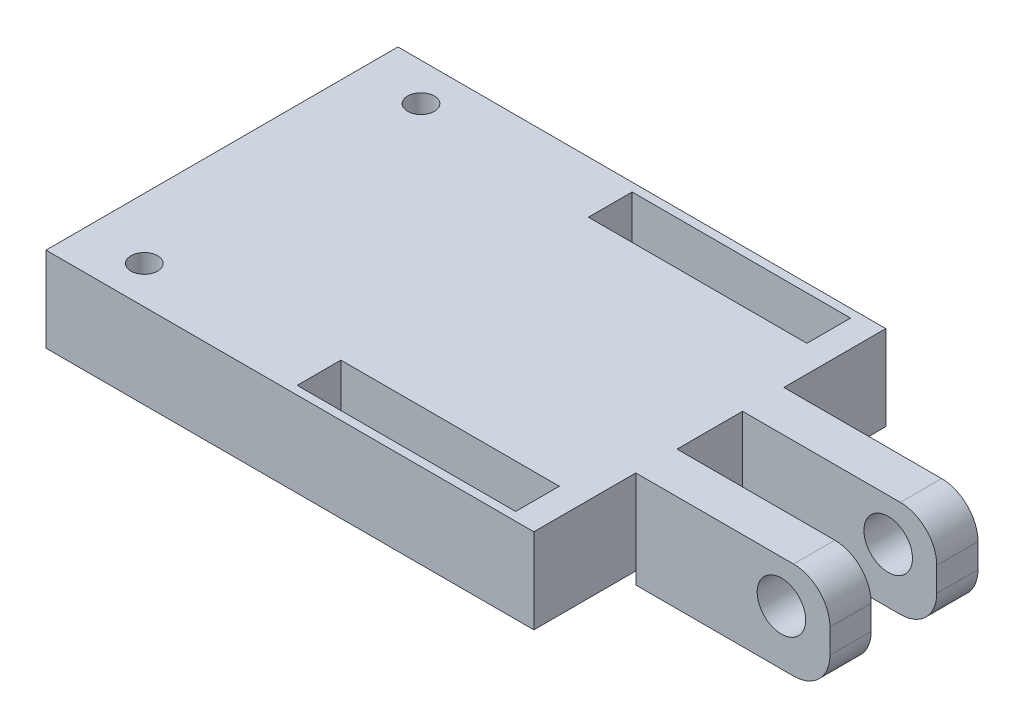
from build123d import *

# Parameters (mm, degrees)
SKETCH2_W               = 50.8
SKETCH2_H               = 36.83
BOSS_EXTRUDE1_DEPTH     = 8.89
SKETCH14_W              = 36.83
SKETCH14_H              = 8.89
BOSS_EXTRUDE6_DEPTH     = 0.254
SKETCH15_W              = 4.318
SKETCH15_H              = 10.16
BOSS_EXTRUDE7_DEPTH     = 20.32
CUT_EXTRUDE3_DEPTH      = 54.86357322
CUT_EXTRUDE3_DEPTH_BACK = 54.86357322
SKETCH16_R              = 2.54
FILLET1_R               = 3.81
SKETCH18_R              = 1.397
CUT_EXTRUDE5_DEPTH      = 2.286
SKETCH18_5_W            = 22.86
SKETCH18_5_H            = 4.572
CUT_EXTRUDE6_DEPTH      = 7.62
SKETCH18_6_W            = 22.86
SKETCH18_6_H            = 4.572
CUT_EXTRUDE7_DEPTH      = 7.62


with BuildPart() as part:
    # Sketch2 → Boss-Extrude1 (new body)
    with BuildSketch(Plane(origin=(0, 0, 0), x_dir=(1, 0, 0), z_dir=(0, 1, 0))):
        Rectangle(SKETCH2_W, SKETCH2_H)
    extrude(amount=-BOSS_EXTRUDE1_DEPTH)

    # Sketch14 → Boss-Extrude6 (add)
    with BuildSketch(Plane(origin=(25.4, 0, 0), x_dir=(0, 0, -1), z_dir=(1, 0, 0))):
        with Locations((0, -4.445)):
            Rectangle(SKETCH14_W, SKETCH14_H)
    extrude(amount=BOSS_EXTRUDE6_DEPTH)

    # Sketch15 → Boss-Extrude7 (add)
    with BuildSketch(Plane(origin=(25.654, 0, 0), x_dir=(0, 0, -1), z_dir=(1, 0, 0))):
        with Locations((-5.588, -5.08)):
            Rectangle(SKETCH15_W, SKETCH15_H)
        with Locations((5.588, -5.08)):
            Rectangle(SKETCH15_W, SKETCH15_H)
    extrude(amount=BOSS_EXTRUDE7_DEPTH)

    # Sketch16 → Cut-Extrude3 (cut, two sides: drawn at the far end of the back side and taken through both)
    with BuildSketch(Plane(origin=(0, 0, -7.747), x_dir=(-1, 0, 0), z_dir=(0, 0, -1)).offset(-CUT_EXTRUDE3_DEPTH_BACK)):
        with Locations((-40.894, -4.445)):
            Circle(SKETCH16_R)
    extrude(amount=CUT_EXTRUDE3_DEPTH + CUT_EXTRUDE3_DEPTH_BACK, mode=Mode.SUBTRACT)

    # Fillet1
    fillet1_edges = [part.edges().sort_by_distance(p)[0] for p in [
        (45.974, 0, 5.588),
        (45.974, -10.16, 5.588),
        (45.974, 0, -5.588),
        (45.974, -10.16, -5.588),
    ]]
    fillet(fillet1_edges, radius=FILLET1_R)

    # Sketch18 → Cut-Extrude5 (cut)
    with BuildSketch(Plane(origin=(0, 0, 0), x_dir=(1, 0, 0), z_dir=(0, 1, 0))):
        with Locations((-19.05, -14.478)):
            Circle(SKETCH18_R)
        with Locations((-19.05, 14.478)):
            Circle(SKETCH18_R)
    extrude(amount=-CUT_EXTRUDE5_DEPTH, mode=Mode.SUBTRACT)

    # Sketch18<5> → Cut-Extrude6 (cut)
    with BuildSketch(Plane(origin=(0, 0, 0), x_dir=(1, 0, 0), z_dir=(0, 1, 0))):
        with Locations((11.43, 15.24)):
            Rectangle(SKETCH18_5_W, SKETCH18_5_H)
    extrude(amount=-CUT_EXTRUDE6_DEPTH, mode=Mode.SUBTRACT)

    # Sketch18<6> → Cut-Extrude7 (cut)
    with BuildSketch(Plane(origin=(0, 0, 0), x_dir=(1, 0, 0), z_dir=(0, 1, 0))):
        with Locations((11.43, -15.24)):
            Rectangle(SKETCH18_6_W, SKETCH18_6_H)
    extrude(amount=-CUT_EXTRUDE7_DEPTH, mode=Mode.SUBTRACT)


solid = part.part
